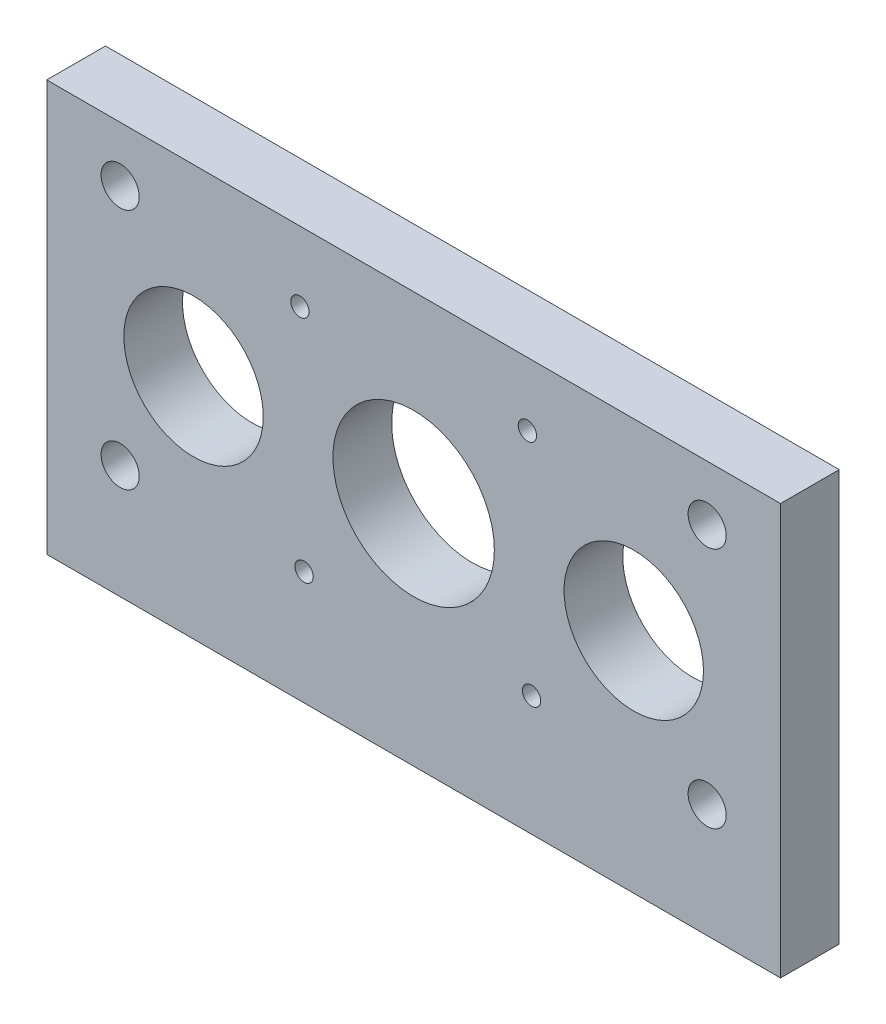
from build123d import *

# Parameters (mm, degrees)
IZIM1_W                              = 100
IZIM1_H                              = 56
IZIM1_R                              = 9.5
IZIM1_R_2                            = 2.031053151
Y_KSEKLIK_EKSTR_ZYON1_DEPTH          = 8
IZIM2_R                              = 11
KES_EKSTR_ZYON1_DEPTH                = 10
IZIM3_R                              = 1.25
KES_EKSTR_ZYON2_DEPTH                = 10
M5_HELISARMAL_I_IN_Z_VANA_MATKAB_1_D = 5.2


with BuildPart() as part:
    # Çizim1 → Yükseklik-Ekstrüzyon1 (new body)
    with BuildSketch(Plane.XY):
        with Locations((-2.031053151, 0.257686676)):
            Rectangle(IZIM1_W, IZIM1_H)
        with Locations((-32.031053151, 3.257686676)):
            Circle(IZIM1_R, mode=Mode.SUBTRACT)
        with Locations((27.968946849, 3.257686676)):
            Circle(IZIM1_R, mode=Mode.SUBTRACT)
        with Locations((-2.031053151, 3.257686676)):
            Circle(IZIM1_R_2, mode=Mode.SUBTRACT)
    extrude(amount=Y_KSEKLIK_EKSTR_ZYON1_DEPTH)

    # Çizim2 → Kes-Ekstrüzyon1 (cut)
    with BuildSketch(Plane.XY.offset(8)):
        with Locations((-2.031053151, 3.257686676)):
            Circle(IZIM2_R)
    extrude(amount=-KES_EKSTR_ZYON1_DEPTH, mode=Mode.SUBTRACT)

    # Çizim3 → Kes-Ekstrüzyon2 (cut)
    with BuildSketch(Plane(origin=(0, 0, 0), x_dir=(-1, 0, 0), z_dir=(0, 0, -1))):
        with Locations((-13.468946849, 19.617369517)):
            Circle(IZIM3_R)
        with Locations((17.531053151, 18.757686676)):
            Circle(IZIM3_R)
        with Locations((16.962368033, -12.242313324)):
            Circle(IZIM3_R)
        with Locations((-14.037631967, -11.382630483)):
            Circle(IZIM3_R)
    extrude(amount=-KES_EKSTR_ZYON2_DEPTH, mode=Mode.SUBTRACT)

    # M5 Helisarmal için Zıvana matkabı1 (through all)
    with Locations(Plane(origin=(-42.031053151, 20.757686676, 8), x_dir=(1, 0, 0), z_dir=(0, 0, 1))):
        with Locations((0, 0), (80, 0), (80, -33), (0, -33)):
            Hole(M5_HELISARMAL_I_IN_Z_VANA_MATKAB_1_D / 2)


solid = part.part
